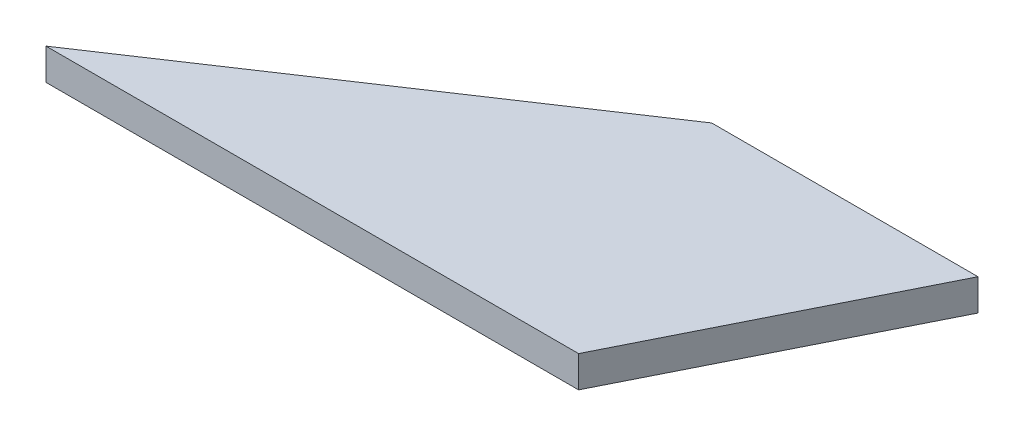
from build123d import *

# Parameters (mm, degrees)
BOSS_EXTRUDE1_DEPTH = 3


with BuildPart() as part:
    # Sketch1 → Boss-Extrude1 (new body)
    with BuildSketch(Plane(origin=(0, 0, 0), x_dir=(1, 0, 0), z_dir=(0, 1, 0))):
        Polygon((0, 0), (50.8, 0), (63.5, 25.4), (38.1, 25.4), align=None)
    extrude(amount=BOSS_EXTRUDE1_DEPTH)


solid = part.part
